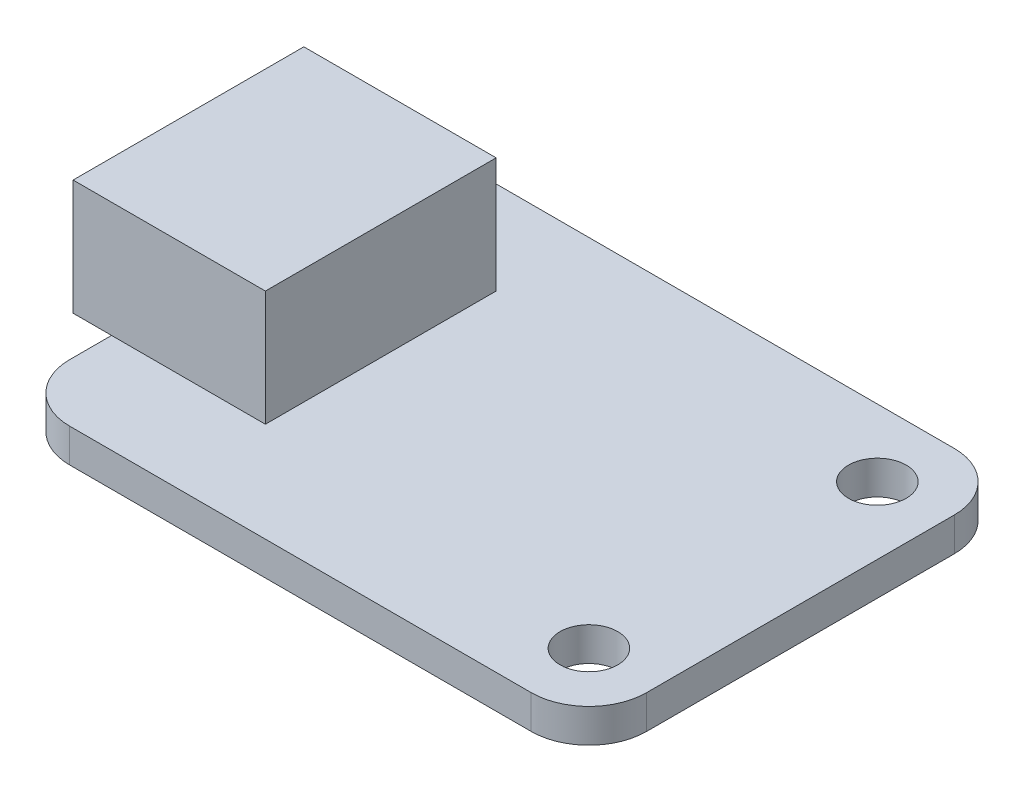
from build123d import *

# Parameters (mm, degrees)
SKETCH1_R           = 1.5
BOSS_EXTRUDE1_DEPTH = 1.75
SKETCH2_W           = 10
SKETCH2_H           = 12
BOSS_EXTRUDE2_DEPTH = 6


with BuildPart() as part:
    # Sketch1 → Boss-Extrude1 (new body)
    with BuildSketch(Plane(origin=(0, 0, 0), x_dir=(1, 0, 0), z_dir=(0, 1, 0))):
        with BuildLine():
            Line((12, 11), (-12, 11))
            ThreePointArc((-12, 11), (-14.121320344, 10.121320344), (-15, 8))
            Line((-15, 8), (-15, -8))
            ThreePointArc((-15, -8), (-14.121320344, -10.121320344), (-12, -11))
            Line((-12, -11), (12, -11))
            ThreePointArc((12, -11), (14.121320344, -10.121320344), (15, -8))
            Line((15, -8), (15, 8))
            ThreePointArc((15, 8), (14.121320344, 10.121320344), (12, 11))
        make_face()
        with Locations((11.5, 7.5)):
            Circle(SKETCH1_R, mode=Mode.SUBTRACT)
        with Locations((11.5, -7.5)):
            Circle(SKETCH1_R, mode=Mode.SUBTRACT)
    extrude(amount=BOSS_EXTRUDE1_DEPTH)

    # Sketch2 → Boss-Extrude2 (add)
    with BuildSketch(Plane(origin=(0, 1.75, 0), x_dir=(1, 0, 0), z_dir=(0, 1, 0))):
        with Locations((-12, 0.174855127)):
            Rectangle(SKETCH2_W, SKETCH2_H)
    extrude(amount=BOSS_EXTRUDE2_DEPTH)


solid = part.part
